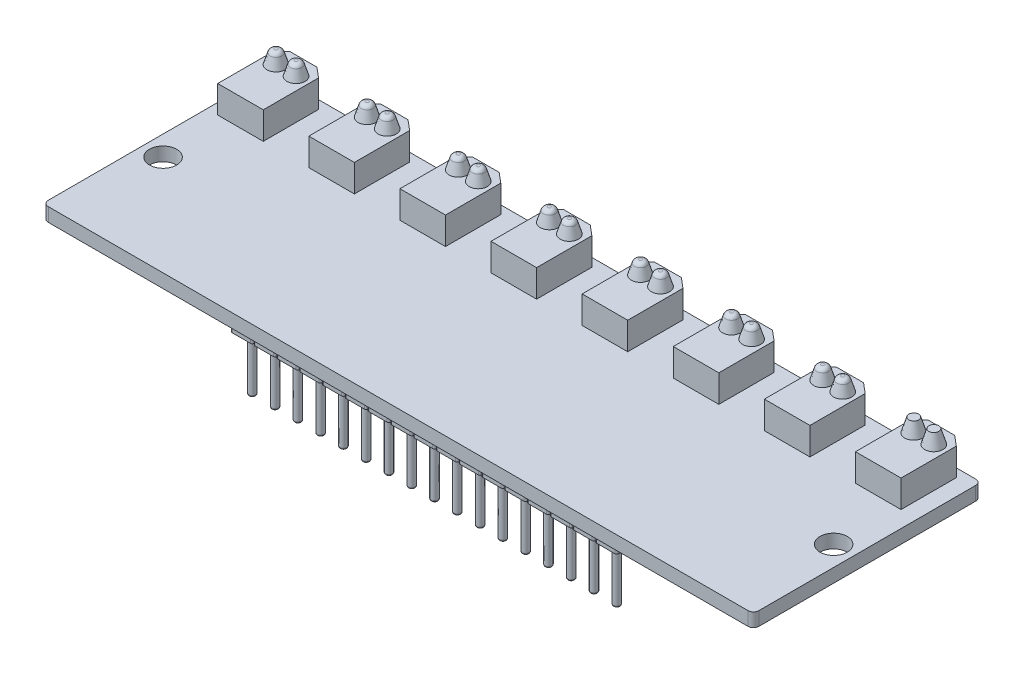
from build123d import *

# Parameters (mm, degrees)
SKETCH1_W                      = 78
SKETCH1_H                      = 25
BOSS_EXTRUDE1_DEPTH            = 1.5
FILLET1_R                      = 0.6
SKETCH2_R                      = 1.5
CUT_EXTRUDE1_DEPTH             = 1.5
BOSS_EXTRUDE2_DEPTH            = 3
SKETCH4_R                      = 1
BOSS_EXTRUDE7_DEPTH            = 1.5
BOSS_EXTRUDE7_DRAFT            = 17
BOSS_EXTRUDE7_PROFILE_2_DEPTH  = 1.5
BOSS_EXTRUDE7_PROFILE_2_DRAFT  = 17
BOSS_EXTRUDE7_PROFILE_3_DEPTH  = 1.5
BOSS_EXTRUDE7_PROFILE_3_DRAFT  = 17
BOSS_EXTRUDE7_PROFILE_4_DEPTH  = 1.5
BOSS_EXTRUDE7_PROFILE_4_DRAFT  = 17
BOSS_EXTRUDE7_PROFILE_5_DEPTH  = 1.5
BOSS_EXTRUDE7_PROFILE_5_DRAFT  = 17
BOSS_EXTRUDE7_PROFILE_6_DEPTH  = 1.5
BOSS_EXTRUDE7_PROFILE_6_DRAFT  = 17
BOSS_EXTRUDE7_PROFILE_7_DEPTH  = 1.5
BOSS_EXTRUDE7_PROFILE_7_DRAFT  = 17
BOSS_EXTRUDE7_PROFILE_8_DEPTH  = 1.5
BOSS_EXTRUDE7_PROFILE_8_DRAFT  = 17
BOSS_EXTRUDE7_PROFILE_9_DEPTH  = 1.5
BOSS_EXTRUDE7_PROFILE_9_DRAFT  = 17
BOSS_EXTRUDE7_PROFILE_10_DEPTH = 1.5
BOSS_EXTRUDE7_PROFILE_10_DRAFT = 17
BOSS_EXTRUDE7_PROFILE_11_DEPTH = 1.5
BOSS_EXTRUDE7_PROFILE_11_DRAFT = 17
BOSS_EXTRUDE7_PROFILE_12_DEPTH = 1.5
BOSS_EXTRUDE7_PROFILE_12_DRAFT = 17
BOSS_EXTRUDE7_PROFILE_13_DEPTH = 1.5
BOSS_EXTRUDE7_PROFILE_13_DRAFT = 17
BOSS_EXTRUDE7_PROFILE_14_DEPTH = 1.5
BOSS_EXTRUDE7_PROFILE_14_DRAFT = 17
BOSS_EXTRUDE7_PROFILE_15_DEPTH = 1.5
BOSS_EXTRUDE7_PROFILE_15_DRAFT = 17
BOSS_EXTRUDE7_PROFILE_16_DEPTH = 1.5
BOSS_EXTRUDE7_PROFILE_16_DRAFT = 17
FILLET4_R                      = 0.5
SKETCH5_W                      = 2.4
SKETCH5_H                      = 2.4
BOSS_EXTRUDE12_DEPTH           = 2
SKETCH6_R                      = 0.375
BOSS_EXTRUDE13_DEPTH           = 6
FILLET5_R                      = 0.2
FILLET7_R                      = 0.2
FILLET8_R                      = 0.2


with BuildPart() as part:
    # Sketch1 → Boss-Extrude1 (new body)
    with BuildSketch(Plane(origin=(0, 0, 0), x_dir=(1, 0, 0), z_dir=(0, 1, 0))):
        Rectangle(SKETCH1_W, SKETCH1_H)
    extrude(amount=BOSS_EXTRUDE1_DEPTH)

    # Fillet1
    fillet1_edges = [part.edges().sort_by_distance(p)[0] for p in [
        (-39, 0.75, -12.5),
        (39, 0.75, -12.5),
        (39, 0.75, 12.5),
        (-39, 0.75, 12.5),
    ]]
    fillet(fillet1_edges, radius=FILLET1_R)

    # Sketch2 → Cut-Extrude1 (cut)
    with BuildSketch(Plane(origin=(0, 1.5, 0), x_dir=(1, 0, 0), z_dir=(0, 1, 0))):
        with Locations(Location((-36.8, -1.5, 0), (0, 0, 270))):
            Circle(SKETCH2_R)
        with Locations(Location((36.8, -1.5, 0), (0, 0, 90))):
            Circle(SKETCH2_R)
    extrude(amount=-CUT_EXTRUDE1_DEPTH, mode=Mode.SUBTRACT)

    # Sketch3 → Boss-Extrude2 (add)
    with BuildSketch(Plane(origin=(0, 1.5, 0), x_dir=(1, 0, 0), z_dir=(0, 1, 0))):
        Polygon((-36.866761268, 12.5), (-33.913958089, 12.5), (-32.8, 11.566761268), (-32.8, 5.5), (-37.8, 5.5), (-37.8, 11.566761268), align=None)
        Polygon((-22.8, 11.566761268), (-22.8, 5.5), (-27.8, 5.5), (-27.8, 11.566761268), (-26.866761268, 12.5), (-23.913958089, 12.5), align=None)
        Polygon((-12.8, 11.566761268), (-12.8, 5.5), (-17.8, 5.5), (-17.8, 11.566761268), (-16.866761268, 12.5), (-13.913958089, 12.5), align=None)
        Polygon((-2.8, 11.566761268), (-2.8, 5.5), (-7.8, 5.5), (-7.8, 11.566761268), (-6.866761268, 12.5), (-3.913958089, 12.5), align=None)
        Polygon((7.2, 11.566761268), (7.2, 5.5), (2.2, 5.5), (2.2, 11.566761268), (3.133238732, 12.5), (6.086041911, 12.5), align=None)
        Polygon((17.2, 11.566761268), (17.2, 5.5), (12.2, 5.5), (12.2, 11.566761268), (13.133238732, 12.5), (16.086041911, 12.5), align=None)
        Polygon((27.2, 11.566761268), (27.2, 5.5), (22.2, 5.5), (22.2, 11.566761268), (23.133238732, 12.5), (26.086041911, 12.5), align=None)
        Polygon((37.2, 11.566761268), (37.2, 5.5), (32.2, 5.5), (32.2, 11.566761268), (33.133238732, 12.5), (36.086041911, 12.5), align=None)
    extrude(amount=BOSS_EXTRUDE2_DEPTH)


with BuildPart() as boss_extrude7_tool:
    # Sketch4 → Boss-Extrude7 (with draft: the straight prism first)
    with BuildSketch(Plane(origin=(0, 4.5, 0), x_dir=(1, 0, 0), z_dir=(0, 1, 0))):
        with Locations((-36.4, 10.499601384)):
            Circle(SKETCH4_R)
    extrude(amount=BOSS_EXTRUDE7_DEPTH)
    # Boss-Extrude7: the draft: its side faces are tilted about the plane it starts from
    boss_extrude7_sides = [boss_extrude7_tool.faces().sort_by_distance(p)[0] for p in [
        (-37.4, 5.25, -10.499601384),
    ]]
    draft(boss_extrude7_sides, Plane(origin=(0, 4.5, 0), x_dir=(1, 0, 0), z_dir=(0, 1, 0)), BOSS_EXTRUDE7_DRAFT)


with BuildPart() as part_1:
    add(part.part)

    # Boss-Extrude7: add boss_extrude7_tool
    add(boss_extrude7_tool.part)


with BuildPart() as boss_extrude7_profile_2_tool:
    # Sketch4 → Boss-Extrude7 profile 2 (with draft: the straight prism first)
    with BuildSketch(Plane(origin=(0, 4.5, 0), x_dir=(1, 0, 0), z_dir=(0, 1, 0))):
        with Locations((-34.2, 10.499601384)):
            Circle(SKETCH4_R)
    extrude(amount=BOSS_EXTRUDE7_PROFILE_2_DEPTH)
    # Boss-Extrude7 profile 2: the draft: its side faces are tilted about the plane it starts from
    boss_extrude7_profile_2_sides = [boss_extrude7_profile_2_tool.faces().sort_by_distance(p)[0] for p in [
        (-35.2, 5.25, -10.499601384),
    ]]
    draft(boss_extrude7_profile_2_sides, Plane(origin=(0, 4.5, 0), x_dir=(1, 0, 0), z_dir=(0, 1, 0)), BOSS_EXTRUDE7_PROFILE_2_DRAFT)


with BuildPart() as part_2:
    add(part_1.part)

    # Boss-Extrude7 profile 2: add boss_extrude7_profile_2_tool
    add(boss_extrude7_profile_2_tool.part)


with BuildPart() as boss_extrude7_profile_3_tool:
    # Sketch4 → Boss-Extrude7 profile 3 (with draft: the straight prism first)
    with BuildSketch(Plane(origin=(0, 4.5, 0), x_dir=(1, 0, 0), z_dir=(0, 1, 0))):
        with Locations((-26.4, 10.499601384)):
            Circle(SKETCH4_R)
    extrude(amount=BOSS_EXTRUDE7_PROFILE_3_DEPTH)
    # Boss-Extrude7 profile 3: the draft: its side faces are tilted about the plane it starts from
    boss_extrude7_profile_3_sides = [boss_extrude7_profile_3_tool.faces().sort_by_distance(p)[0] for p in [
        (-27.4, 5.25, -10.499601384),
    ]]
    draft(boss_extrude7_profile_3_sides, Plane(origin=(0, 4.5, 0), x_dir=(1, 0, 0), z_dir=(0, 1, 0)), BOSS_EXTRUDE7_PROFILE_3_DRAFT)


with BuildPart() as part_3:
    add(part_2.part)

    # Boss-Extrude7 profile 3: add boss_extrude7_profile_3_tool
    add(boss_extrude7_profile_3_tool.part)


with BuildPart() as boss_extrude7_profile_4_tool:
    # Sketch4 → Boss-Extrude7 profile 4 (with draft: the straight prism first)
    with BuildSketch(Plane(origin=(0, 4.5, 0), x_dir=(1, 0, 0), z_dir=(0, 1, 0))):
        with Locations((-24.2, 10.499601384)):
            Circle(SKETCH4_R)
    extrude(amount=BOSS_EXTRUDE7_PROFILE_4_DEPTH)
    # Boss-Extrude7 profile 4: the draft: its side faces are tilted about the plane it starts from
    boss_extrude7_profile_4_sides = [boss_extrude7_profile_4_tool.faces().sort_by_distance(p)[0] for p in [
        (-25.2, 5.25, -10.499601384),
    ]]
    draft(boss_extrude7_profile_4_sides, Plane(origin=(0, 4.5, 0), x_dir=(1, 0, 0), z_dir=(0, 1, 0)), BOSS_EXTRUDE7_PROFILE_4_DRAFT)


with BuildPart() as part_4:
    add(part_3.part)

    # Boss-Extrude7 profile 4: add boss_extrude7_profile_4_tool
    add(boss_extrude7_profile_4_tool.part)


with BuildPart() as boss_extrude7_profile_5_tool:
    # Sketch4 → Boss-Extrude7 profile 5 (with draft: the straight prism first)
    with BuildSketch(Plane(origin=(0, 4.5, 0), x_dir=(1, 0, 0), z_dir=(0, 1, 0))):
        with Locations((-16.4, 10.499601384)):
            Circle(SKETCH4_R)
    extrude(amount=BOSS_EXTRUDE7_PROFILE_5_DEPTH)
    # Boss-Extrude7 profile 5: the draft: its side faces are tilted about the plane it starts from
    boss_extrude7_profile_5_sides = [boss_extrude7_profile_5_tool.faces().sort_by_distance(p)[0] for p in [
        (-17.4, 5.25, -10.499601384),
    ]]
    draft(boss_extrude7_profile_5_sides, Plane(origin=(0, 4.5, 0), x_dir=(1, 0, 0), z_dir=(0, 1, 0)), BOSS_EXTRUDE7_PROFILE_5_DRAFT)


with BuildPart() as part_5:
    add(part_4.part)

    # Boss-Extrude7 profile 5: add boss_extrude7_profile_5_tool
    add(boss_extrude7_profile_5_tool.part)


with BuildPart() as boss_extrude7_profile_6_tool:
    # Sketch4 → Boss-Extrude7 profile 6 (with draft: the straight prism first)
    with BuildSketch(Plane(origin=(0, 4.5, 0), x_dir=(1, 0, 0), z_dir=(0, 1, 0))):
        with Locations((-14.2, 10.499601384)):
            Circle(SKETCH4_R)
    extrude(amount=BOSS_EXTRUDE7_PROFILE_6_DEPTH)
    # Boss-Extrude7 profile 6: the draft: its side faces are tilted about the plane it starts from
    boss_extrude7_profile_6_sides = [boss_extrude7_profile_6_tool.faces().sort_by_distance(p)[0] for p in [
        (-15.2, 5.25, -10.499601384),
    ]]
    draft(boss_extrude7_profile_6_sides, Plane(origin=(0, 4.5, 0), x_dir=(1, 0, 0), z_dir=(0, 1, 0)), BOSS_EXTRUDE7_PROFILE_6_DRAFT)


with BuildPart() as part_6:
    add(part_5.part)

    # Boss-Extrude7 profile 6: add boss_extrude7_profile_6_tool
    add(boss_extrude7_profile_6_tool.part)


with BuildPart() as boss_extrude7_profile_7_tool:
    # Sketch4 → Boss-Extrude7 profile 7 (with draft: the straight prism first)
    with BuildSketch(Plane(origin=(0, 4.5, 0), x_dir=(1, 0, 0), z_dir=(0, 1, 0))):
        with Locations((-6.4, 10.499601384)):
            Circle(SKETCH4_R)
    extrude(amount=BOSS_EXTRUDE7_PROFILE_7_DEPTH)
    # Boss-Extrude7 profile 7: the draft: its side faces are tilted about the plane it starts from
    boss_extrude7_profile_7_sides = [boss_extrude7_profile_7_tool.faces().sort_by_distance(p)[0] for p in [
        (-7.4, 5.25, -10.499601384),
    ]]
    draft(boss_extrude7_profile_7_sides, Plane(origin=(0, 4.5, 0), x_dir=(1, 0, 0), z_dir=(0, 1, 0)), BOSS_EXTRUDE7_PROFILE_7_DRAFT)


with BuildPart() as part_7:
    add(part_6.part)

    # Boss-Extrude7 profile 7: add boss_extrude7_profile_7_tool
    add(boss_extrude7_profile_7_tool.part)


with BuildPart() as boss_extrude7_profile_8_tool:
    # Sketch4 → Boss-Extrude7 profile 8 (with draft: the straight prism first)
    with BuildSketch(Plane(origin=(0, 4.5, 0), x_dir=(1, 0, 0), z_dir=(0, 1, 0))):
        with Locations((-4.2, 10.499601384)):
            Circle(SKETCH4_R)
    extrude(amount=BOSS_EXTRUDE7_PROFILE_8_DEPTH)
    # Boss-Extrude7 profile 8: the draft: its side faces are tilted about the plane it starts from
    boss_extrude7_profile_8_sides = [boss_extrude7_profile_8_tool.faces().sort_by_distance(p)[0] for p in [
        (-5.2, 5.25, -10.499601384),
    ]]
    draft(boss_extrude7_profile_8_sides, Plane(origin=(0, 4.5, 0), x_dir=(1, 0, 0), z_dir=(0, 1, 0)), BOSS_EXTRUDE7_PROFILE_8_DRAFT)


with BuildPart() as part_8:
    add(part_7.part)

    # Boss-Extrude7 profile 8: add boss_extrude7_profile_8_tool
    add(boss_extrude7_profile_8_tool.part)


with BuildPart() as boss_extrude7_profile_9_tool:
    # Sketch4 → Boss-Extrude7 profile 9 (with draft: the straight prism first)
    with BuildSketch(Plane(origin=(0, 4.5, 0), x_dir=(1, 0, 0), z_dir=(0, 1, 0))):
        with Locations((3.6, 10.499601384)):
            Circle(SKETCH4_R)
    extrude(amount=BOSS_EXTRUDE7_PROFILE_9_DEPTH)
    # Boss-Extrude7 profile 9: the draft: its side faces are tilted about the plane it starts from
    boss_extrude7_profile_9_sides = [boss_extrude7_profile_9_tool.faces().sort_by_distance(p)[0] for p in [
        (2.6, 5.25, -10.499601384),
    ]]
    draft(boss_extrude7_profile_9_sides, Plane(origin=(0, 4.5, 0), x_dir=(1, 0, 0), z_dir=(0, 1, 0)), BOSS_EXTRUDE7_PROFILE_9_DRAFT)


with BuildPart() as part_9:
    add(part_8.part)

    # Boss-Extrude7 profile 9: add boss_extrude7_profile_9_tool
    add(boss_extrude7_profile_9_tool.part)


with BuildPart() as boss_extrude7_profile_10_tool:
    # Sketch4 → Boss-Extrude7 profile 10 (with draft: the straight prism first)
    with BuildSketch(Plane(origin=(0, 4.5, 0), x_dir=(1, 0, 0), z_dir=(0, 1, 0))):
        with Locations((5.8, 10.499601384)):
            Circle(SKETCH4_R)
    extrude(amount=BOSS_EXTRUDE7_PROFILE_10_DEPTH)
    # Boss-Extrude7 profile 10: the draft: its side faces are tilted about the plane it starts from
    boss_extrude7_profile_10_sides = [boss_extrude7_profile_10_tool.faces().sort_by_distance(p)[0] for p in [
        (4.8, 5.25, -10.499601384),
    ]]
    draft(boss_extrude7_profile_10_sides, Plane(origin=(0, 4.5, 0), x_dir=(1, 0, 0), z_dir=(0, 1, 0)), BOSS_EXTRUDE7_PROFILE_10_DRAFT)


with BuildPart() as part_10:
    add(part_9.part)

    # Boss-Extrude7 profile 10: add boss_extrude7_profile_10_tool
    add(boss_extrude7_profile_10_tool.part)


with BuildPart() as boss_extrude7_profile_11_tool:
    # Sketch4 → Boss-Extrude7 profile 11 (with draft: the straight prism first)
    with BuildSketch(Plane(origin=(0, 4.5, 0), x_dir=(1, 0, 0), z_dir=(0, 1, 0))):
        with Locations((13.6, 10.499601384)):
            Circle(SKETCH4_R)
    extrude(amount=BOSS_EXTRUDE7_PROFILE_11_DEPTH)
    # Boss-Extrude7 profile 11: the draft: its side faces are tilted about the plane it starts from
    boss_extrude7_profile_11_sides = [boss_extrude7_profile_11_tool.faces().sort_by_distance(p)[0] for p in [
        (12.6, 5.25, -10.499601384),
    ]]
    draft(boss_extrude7_profile_11_sides, Plane(origin=(0, 4.5, 0), x_dir=(1, 0, 0), z_dir=(0, 1, 0)), BOSS_EXTRUDE7_PROFILE_11_DRAFT)


with BuildPart() as part_11:
    add(part_10.part)

    # Boss-Extrude7 profile 11: add boss_extrude7_profile_11_tool
    add(boss_extrude7_profile_11_tool.part)


with BuildPart() as boss_extrude7_profile_12_tool:
    # Sketch4 → Boss-Extrude7 profile 12 (with draft: the straight prism first)
    with BuildSketch(Plane(origin=(0, 4.5, 0), x_dir=(1, 0, 0), z_dir=(0, 1, 0))):
        with Locations((15.8, 10.499601384)):
            Circle(SKETCH4_R)
    extrude(amount=BOSS_EXTRUDE7_PROFILE_12_DEPTH)
    # Boss-Extrude7 profile 12: the draft: its side faces are tilted about the plane it starts from
    boss_extrude7_profile_12_sides = [boss_extrude7_profile_12_tool.faces().sort_by_distance(p)[0] for p in [
        (14.8, 5.25, -10.499601384),
    ]]
    draft(boss_extrude7_profile_12_sides, Plane(origin=(0, 4.5, 0), x_dir=(1, 0, 0), z_dir=(0, 1, 0)), BOSS_EXTRUDE7_PROFILE_12_DRAFT)


with BuildPart() as part_12:
    add(part_11.part)

    # Boss-Extrude7 profile 12: add boss_extrude7_profile_12_tool
    add(boss_extrude7_profile_12_tool.part)


with BuildPart() as boss_extrude7_profile_13_tool:
    # Sketch4 → Boss-Extrude7 profile 13 (with draft: the straight prism first)
    with BuildSketch(Plane(origin=(0, 4.5, 0), x_dir=(1, 0, 0), z_dir=(0, 1, 0))):
        with Locations((23.6, 10.499601384)):
            Circle(SKETCH4_R)
    extrude(amount=BOSS_EXTRUDE7_PROFILE_13_DEPTH)
    # Boss-Extrude7 profile 13: the draft: its side faces are tilted about the plane it starts from
    boss_extrude7_profile_13_sides = [boss_extrude7_profile_13_tool.faces().sort_by_distance(p)[0] for p in [
        (22.6, 5.25, -10.499601384),
    ]]
    draft(boss_extrude7_profile_13_sides, Plane(origin=(0, 4.5, 0), x_dir=(1, 0, 0), z_dir=(0, 1, 0)), BOSS_EXTRUDE7_PROFILE_13_DRAFT)


with BuildPart() as part_13:
    add(part_12.part)

    # Boss-Extrude7 profile 13: add boss_extrude7_profile_13_tool
    add(boss_extrude7_profile_13_tool.part)


with BuildPart() as boss_extrude7_profile_14_tool:
    # Sketch4 → Boss-Extrude7 profile 14 (with draft: the straight prism first)
    with BuildSketch(Plane(origin=(0, 4.5, 0), x_dir=(1, 0, 0), z_dir=(0, 1, 0))):
        with Locations((25.8, 10.499601384)):
            Circle(SKETCH4_R)
    extrude(amount=BOSS_EXTRUDE7_PROFILE_14_DEPTH)
    # Boss-Extrude7 profile 14: the draft: its side faces are tilted about the plane it starts from
    boss_extrude7_profile_14_sides = [boss_extrude7_profile_14_tool.faces().sort_by_distance(p)[0] for p in [
        (24.8, 5.25, -10.499601384),
    ]]
    draft(boss_extrude7_profile_14_sides, Plane(origin=(0, 4.5, 0), x_dir=(1, 0, 0), z_dir=(0, 1, 0)), BOSS_EXTRUDE7_PROFILE_14_DRAFT)


with BuildPart() as part_14:
    add(part_13.part)

    # Boss-Extrude7 profile 14: add boss_extrude7_profile_14_tool
    add(boss_extrude7_profile_14_tool.part)


with BuildPart() as boss_extrude7_profile_15_tool:
    # Sketch4 → Boss-Extrude7 profile 15 (with draft: the straight prism first)
    with BuildSketch(Plane(origin=(0, 4.5, 0), x_dir=(1, 0, 0), z_dir=(0, 1, 0))):
        with Locations((33.6, 10.499601384)):
            Circle(SKETCH4_R)
    extrude(amount=BOSS_EXTRUDE7_PROFILE_15_DEPTH)
    # Boss-Extrude7 profile 15: the draft: its side faces are tilted about the plane it starts from
    boss_extrude7_profile_15_sides = [boss_extrude7_profile_15_tool.faces().sort_by_distance(p)[0] for p in [
        (32.6, 5.25, -10.499601384),
    ]]
    draft(boss_extrude7_profile_15_sides, Plane(origin=(0, 4.5, 0), x_dir=(1, 0, 0), z_dir=(0, 1, 0)), BOSS_EXTRUDE7_PROFILE_15_DRAFT)


with BuildPart() as part_15:
    add(part_14.part)

    # Boss-Extrude7 profile 15: add boss_extrude7_profile_15_tool
    add(boss_extrude7_profile_15_tool.part)


with BuildPart() as boss_extrude7_profile_16_tool:
    # Sketch4 → Boss-Extrude7 profile 16 (with draft: the straight prism first)
    with BuildSketch(Plane(origin=(0, 4.5, 0), x_dir=(1, 0, 0), z_dir=(0, 1, 0))):
        with Locations((35.8, 10.499601384)):
            Circle(SKETCH4_R)
    extrude(amount=BOSS_EXTRUDE7_PROFILE_16_DEPTH)
    # Boss-Extrude7 profile 16: the draft: its side faces are tilted about the plane it starts from
    boss_extrude7_profile_16_sides = [boss_extrude7_profile_16_tool.faces().sort_by_distance(p)[0] for p in [
        (34.8, 5.25, -10.499601384),
    ]]
    draft(boss_extrude7_profile_16_sides, Plane(origin=(0, 4.5, 0), x_dir=(1, 0, 0), z_dir=(0, 1, 0)), BOSS_EXTRUDE7_PROFILE_16_DRAFT)


with BuildPart() as part_16:
    add(part_15.part)

    # Boss-Extrude7 profile 16: add boss_extrude7_profile_16_tool
    add(boss_extrude7_profile_16_tool.part)

    # Fillet4
    fillet4_edges = [part_16.edges().sort_by_distance(p)[0] for p in [
        (-36.941403978, 6, -10.499601384),
        (-34.741403978, 6, -10.499601384),
        (-26.941403978, 6, -10.499601384),
        (-24.741403978, 6, -10.499601384),
        (-16.941403978, 6, -10.499601384),
        (-14.741403978, 6, -10.499601384),
        (-6.941403978, 6, -10.499601384),
        (-4.741403978, 6, -10.499601384),
        (3.058596022, 6, -10.499601384),
        (5.258596022, 6, -10.499601384),
        (13.058596022, 6, -10.499601384),
        (15.258596022, 6, -10.499601384),
        (23.058596022, 6, -10.499601384),
        (25.258596022, 6, -10.499601384),
    ]]
    fillet(fillet4_edges, radius=FILLET4_R)

    # Sketch5 → Boss-Extrude12 (add)
    with BuildSketch(Plane.XZ):
        with Locations((-16.3, 9.7)):
            Rectangle(SKETCH5_W, SKETCH5_H)
        with Locations((-13.8, 9.7)):
            Rectangle(SKETCH5_W, SKETCH5_H)
        with Locations((-11.3, 9.7)):
            Rectangle(SKETCH5_W, SKETCH5_H)
        with Locations((-8.8, 9.7)):
            Rectangle(SKETCH5_W, SKETCH5_H)
        with Locations((-6.3, 9.7)):
            Rectangle(SKETCH5_W, SKETCH5_H)
        with Locations((-18.8, 9.7)):
            Rectangle(SKETCH5_W, SKETCH5_H)
        with Locations((-3.8, 9.7)):
            Rectangle(SKETCH5_W, SKETCH5_H)
        with Locations((-1.3, 9.7)):
            Rectangle(SKETCH5_W, SKETCH5_H)
        with Locations((1.2, 9.7)):
            Rectangle(SKETCH5_W, SKETCH5_H)
        with Locations((3.7, 9.7)):
            Rectangle(SKETCH5_W, SKETCH5_H)
        with Locations((6.2, 9.7)):
            Rectangle(SKETCH5_W, SKETCH5_H)
        with Locations((8.7, 9.7)):
            Rectangle(SKETCH5_W, SKETCH5_H)
        with Locations((11.2, 9.7)):
            Rectangle(SKETCH5_W, SKETCH5_H)
        with Locations((13.7, 9.7)):
            Rectangle(SKETCH5_W, SKETCH5_H)
        with Locations((16.2, 9.7)):
            Rectangle(SKETCH5_W, SKETCH5_H)
        with Locations((18.7, 9.7)):
            Rectangle(SKETCH5_W, SKETCH5_H)
        with Locations((21.2, 9.7)):
            Rectangle(SKETCH5_W, SKETCH5_H)
    extrude(amount=BOSS_EXTRUDE12_DEPTH)

    # Sketch6 → Boss-Extrude13 (add)
    with BuildSketch(Plane.XZ.offset(2)):
        with Locations(Location((-18.8, 9.7, 0), (0, 0, 270))):
            Circle(SKETCH6_R)
        with Locations(Location((-16.3, 9.7, 0), (0, 0, 270))):
            Circle(SKETCH6_R)
        with Locations(Location((-13.8, 9.7, 0), (0, 0, 270))):
            Circle(SKETCH6_R)
        with Locations(Location((-11.3, 9.7, 0), (0, 0, 270))):
            Circle(SKETCH6_R)
        with Locations(Location((-8.8, 9.7, 0), (0, 0, 270))):
            Circle(SKETCH6_R)
        with Locations(Location((-6.3, 9.7, 0), (0, 0, 270))):
            Circle(SKETCH6_R)
        with Locations(Location((-3.8, 9.7, 0), (0, 0, 270))):
            Circle(SKETCH6_R)
        with Locations(Location((-1.3, 9.7, 0), (0, 0, 270))):
            Circle(SKETCH6_R)
        with Locations(Location((1.2, 9.7, 0), (0, 0, 270))):
            Circle(SKETCH6_R)
        with Locations(Location((3.7, 9.7, 0), (0, 0, 270))):
            Circle(SKETCH6_R)
        with Locations(Location((6.2, 9.7, 0), (0, 0, 270))):
            Circle(SKETCH6_R)
        with Locations(Location((8.7, 9.7, 0), (0, 0, 270))):
            Circle(SKETCH6_R)
        with Locations(Location((11.2, 9.7, 0), (0, 0, 270))):
            Circle(SKETCH6_R)
        with Locations(Location((13.7, 9.7, 0), (0, 0, 270))):
            Circle(SKETCH6_R)
        with Locations(Location((16.2, 9.7, 0), (0, 0, 270))):
            Circle(SKETCH6_R)
        with Locations(Location((18.7, 9.7, 0), (0, 0, 270))):
            Circle(SKETCH6_R)
        with Locations(Location((21.2, 9.7, 0), (0, 0, 270))):
            Circle(SKETCH6_R)
    extrude(amount=BOSS_EXTRUDE13_DEPTH)

    # Fillet5
    fillet5_edges = [part_16.edges().sort_by_distance(p)[0] for p in [
        (-17.6, -1, 10.9),
        (-20, -1, 10.9),
        (-20, -1, 8.5),
        (-17.6, -1, 8.5),
    ]]
    fillet(fillet5_edges, radius=FILLET5_R)

    # Fillet7
    fillet7_edges = [part_16.edges().sort_by_distance(p)[0] for p in [
        (-15.1, -1, 10.9),
        (-17.5, -1, 10.9),
        (-17.5, -1, 8.5),
        (-15.1, -1, 8.5),
        (-12.6, -1, 10.9),
        (-15, -1, 10.9),
        (-15, -1, 8.5),
        (-12.6, -1, 8.5),
        (-10.1, -1, 10.9),
        (-12.5, -1, 10.9),
        (-12.5, -1, 8.5),
        (-10.1, -1, 8.5),
        (-7.6, -1, 10.9),
        (-10, -1, 10.9),
        (-10, -1, 8.5),
        (-7.6, -1, 8.5),
        (-5.1, -1, 10.9),
        (-7.5, -1, 10.9),
        (-7.5, -1, 8.5),
        (-5.1, -1, 8.5),
        (-2.6, -1, 10.9),
        (-5, -1, 10.9),
        (-5, -1, 8.5),
        (-2.6, -1, 8.5),
        (-0.1, -1, 10.9),
        (-2.5, -1, 10.9),
        (-2.5, -1, 8.5),
        (-0.1, -1, 8.5),
        (2.4, -1, 10.9),
        (0, -1, 10.9),
        (0, -1, 8.5),
        (2.4, -1, 8.5),
        (4.9, -1, 10.9),
        (2.5, -1, 10.9),
        (2.5, -1, 8.5),
        (4.9, -1, 8.5),
        (7.4, -1, 10.9),
        (5, -1, 10.9),
        (5, -1, 8.5),
        (7.4, -1, 8.5),
        (9.9, -1, 10.9),
        (7.5, -1, 10.9),
        (7.5, -1, 8.5),
        (9.9, -1, 8.5),
        (12.4, -1, 10.9),
        (10, -1, 10.9),
        (10, -1, 8.5),
        (12.4, -1, 8.5),
        (14.9, -1, 10.9),
        (12.5, -1, 10.9),
        (12.5, -1, 8.5),
        (14.9, -1, 8.5),
        (17.4, -1, 10.9),
        (15, -1, 10.9),
        (15, -1, 8.5),
        (17.4, -1, 8.5),
        (19.9, -1, 10.9),
        (17.5, -1, 10.9),
        (17.5, -1, 8.5),
        (19.9, -1, 8.5),
        (22.4, -1, 10.9),
        (20, -1, 10.9),
        (20, -1, 8.5),
        (22.4, -1, 8.5),
    ]]
    fillet(fillet7_edges, radius=FILLET7_R)

    # Fillet8
    fillet8_edges = [part_16.edges().sort_by_distance(p)[0] for p in [
        (-18.8, -8, 10.075),
        (-16.3, -8, 10.075),
        (-13.8, -8, 10.075),
        (-11.3, -8, 10.075),
        (-8.8, -8, 10.075),
        (-6.3, -8, 10.075),
        (-3.8, -8, 10.075),
        (-1.3, -8, 10.075),
        (1.2, -8, 10.075),
        (3.7, -8, 10.075),
        (6.2, -8, 10.075),
        (8.7, -8, 10.075),
        (11.2, -8, 10.075),
        (13.7, -8, 10.075),
        (16.2, -8, 10.075),
        (18.7, -8, 10.075),
        (21.2, -8, 10.075),
    ]]
    fillet(fillet8_edges, radius=FILLET8_R)


solid = part_16.part
